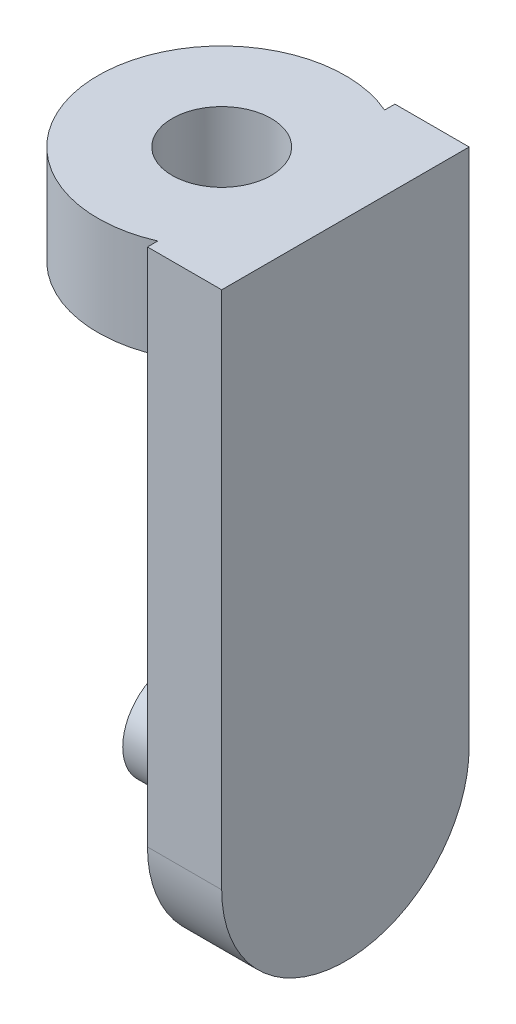
from build123d import *

# Parameters (mm, degrees)
SKETCH1_R           = 2.5
SKETCH1_R_2         = 1
BOSS_EXTRUDE1_DEPTH = 1
BOSS_EXTRUDE2_DEPTH = 1.5
SKETCH5_R           = 1
BOSS_EXTRUDE3_DEPTH = 2


with BuildPart() as part:
    # Sketch1 → Boss-Extrude1 (new, symmetric)
    with BuildSketch(Plane(origin=(0, 0, 0), x_dir=(1, 0, 0), z_dir=(0, 1, 0))):
        with Locations(Location((0, 0, 0), (0, 0, 270))):
            Circle(SKETCH1_R)
        with Locations(Location((0, 0, 0), (0, 0, 270))):
            Circle(SKETCH1_R_2, mode=Mode.SUBTRACT)
    extrude(amount=BOSS_EXTRUDE1_DEPTH, both=True)

    # Sketch2 → Boss-Extrude2 (add)
    with BuildSketch(Plane(origin=(2.5, 0, 0), x_dir=(0, 0, -1), z_dir=(1, 0, 0))):
        with BuildLine():
            Line((-2.5, 1), (2.5, 1))
            Line((2.5, 1), (2.5, -9.5))
            ThreePointArc((2.5, -9.5), (0, -12), (-2.5, -9.5))
            Line((-2.5, -9.5), (-2.5, 1))
        make_face()
    extrude(amount=-BOSS_EXTRUDE2_DEPTH)

    # Sketch5 → Boss-Extrude3 (add)
    with BuildSketch(Plane.ZY.offset(-1)):
        with Locations((0, -9.5)):
            Circle(SKETCH5_R)
    extrude(amount=BOSS_EXTRUDE3_DEPTH)


solid = part.part
